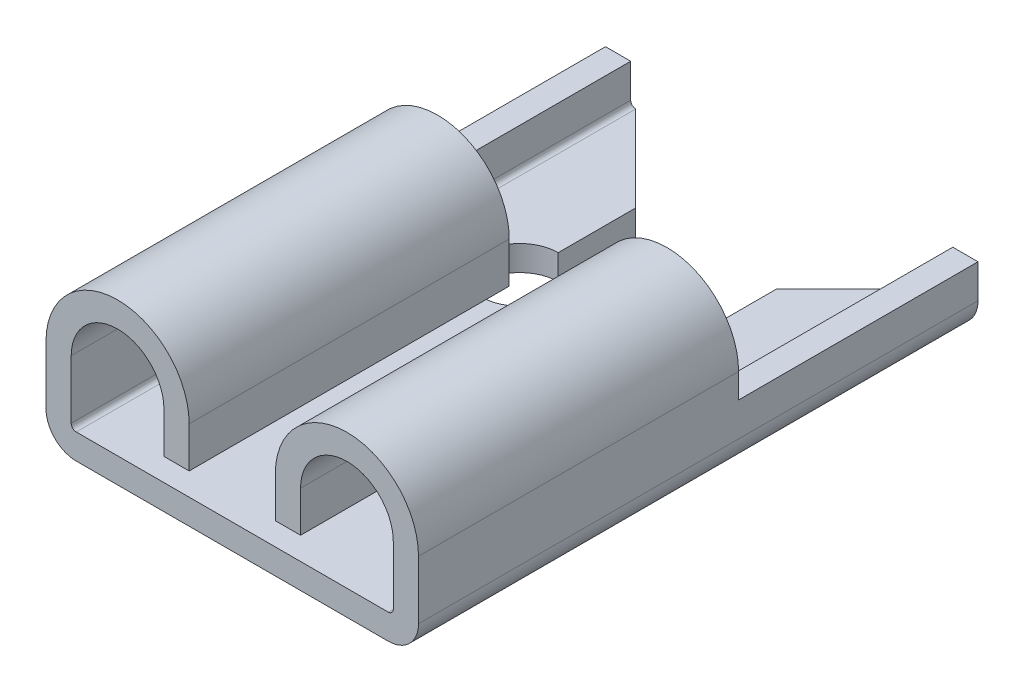
from build123d import *

# Parameters (mm, degrees)
BOSS_EXTRUDE1_DEPTH = 11.1
CUT_EXTRUDE1_REACH  = 14.123
CUT_EXTRUDE2_DEPTH  = 4.75


with BuildPart() as part:
    # Sketch1 → Boss-Extrude1 (new body)
    with BuildSketch(Plane.XY):
        with BuildLine():
            Line((0, 0), (-3.095, 0))
            ThreePointArc((-3.095, 0), (-3.519264069, 0.175735931), (-3.695, 0.6))
            Line((-3.695, 0.6), (-3.695, 1.76))
            ThreePointArc((-3.695, 1.76), (-2.275, 3.18), (-0.855, 1.76))
            Line((-0.855, 1.76), (-0.855, 0.95))
            Line((-0.855, 0.95), (-1.355, 0.95))
            Line((-1.355, 0.95), (-1.355, 1.76))
            ThreePointArc((-1.355, 1.76), (-2.275, 2.68), (-3.195, 1.76))
            Line((-3.195, 1.76), (-3.195, 0.6))
            ThreePointArc((-3.195, 0.6), (-3.165710678, 0.529289322), (-3.095, 0.5))
            Line((-3.095, 0.5), (0, 0.5))
            Line((0, 0.5), (3.095, 0.5))
            ThreePointArc((3.095, 0.5), (3.165710678, 0.529289322), (3.195, 0.6))
            Line((3.195, 0.6), (3.195, 1.76))
            ThreePointArc((3.195, 1.76), (2.275, 2.68), (1.355, 1.76))
            Line((1.355, 1.76), (1.355, 0.95))
            Line((1.355, 0.95), (0.855, 0.95))
            Line((0.855, 0.95), (0.855, 1.76))
            ThreePointArc((0.855, 1.76), (2.275, 3.18), (3.695, 1.76))
            Line((3.695, 1.76), (3.695, 0.6))
            ThreePointArc((3.695, 0.6), (3.519264069, 0.175735931), (3.095, 0))
            Line((3.095, 0), (0, 0))
        make_face()
    extrude(amount=BOSS_EXTRUDE1_DEPTH)

    # Sketch2 → Cut-Extrude1 (cut, up to next)
    with BuildSketch(Plane.XZ, mode=Mode.PRIVATE) as cut_extrude1_sk1:
        with BuildLine():
            Line((-0.633, 4), (0.633, 4))
            ThreePointArc((0.633, 4), (1.933815367, 4.538815367), (1.395, 3.238))
            Line((1.395, 3.238), (1.395, 1.7))
            Line((1.395, 1.7), (3.095, 0))
            Line((3.095, 0), (3.095, -0.537500588))
            Line((3.095, -0.537500588), (-3.095, -0.537500588))
            Line((-3.095, -0.537500588), (-3.095, 0))
            Line((-3.095, 0), (-1.395, 1.7))
            Line((-1.395, 1.7), (-1.395, 3.238))
            ThreePointArc((-1.395, 3.238), (-1.933815367, 4.538815367), (-0.633, 4))
        make_face()
    cut_extrude1_tool1 = extrude(cut_extrude1_sk1.sketch, amount=-CUT_EXTRUDE1_REACH, mode=Mode.PRIVATE) & part.part
    add(cut_extrude1_tool1.solids().sort_by_distance((0, 0, 1.705502))[0], mode=Mode.SUBTRACT)

    # Sketch3 → Cut-Extrude2 (cut)
    with BuildSketch(Plane(origin=(0, 0, 0), x_dir=(-1, 0, 0), z_dir=(0, 0, -1))):
        Polygon((3.695, 3.311724778), (-3.695, 3.311724778), (-3.695, 1.27), (-2.941, 1.27), (-2.941, 0.77), (2.941, 0.77), (2.941, 1.27), (3.695, 1.27), align=None)
    extrude(amount=-CUT_EXTRUDE2_DEPTH, mode=Mode.SUBTRACT)


solid = part.part
